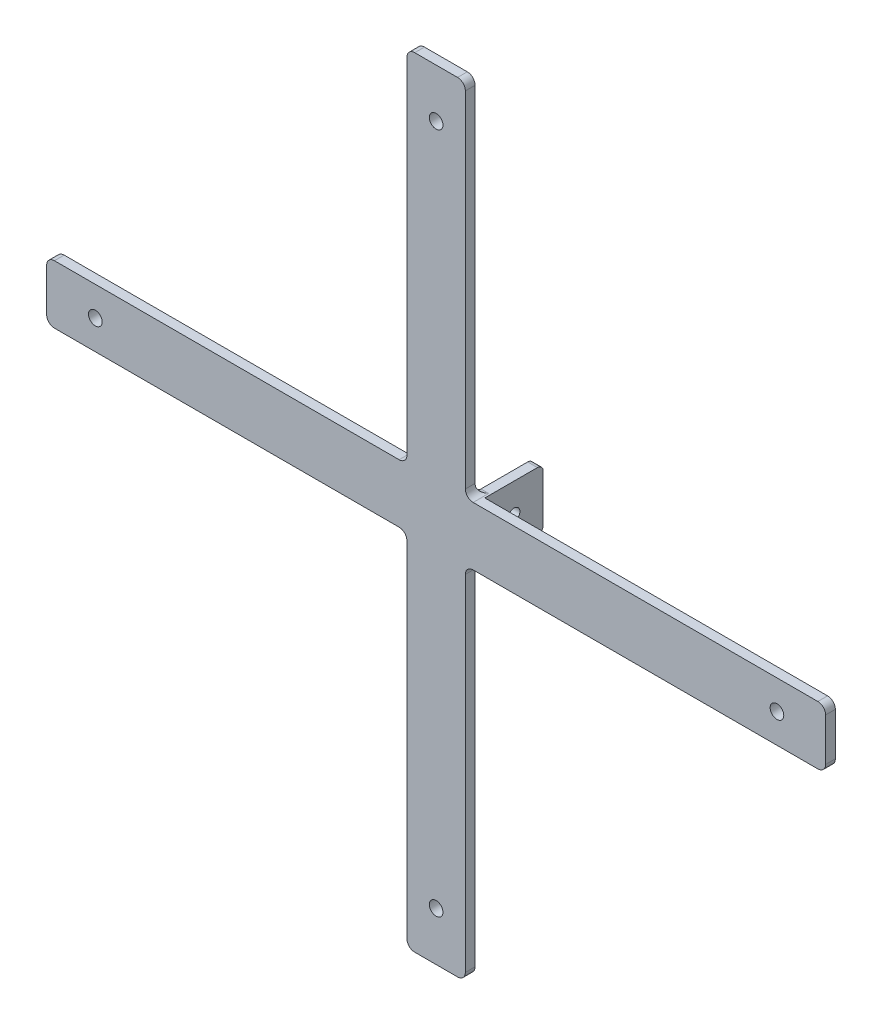
from build123d import *

# Parameters (mm, degrees)
SKETCH1_W               = 185
SKETCH1_H               = 30
SKETCH1_W_2             = 30
SKETCH1_H_2             = 185
BOSS_EXTRUDE1_DEPTH     = 5
SKETCH2_W               = 5
SKETCH2_H               = 30
BOSS_EXTRUDE2_DEPTH     = 30
CUT_EXTRUDE1_DEPTH      = 299.83105595
CUT_EXTRUDE1_DEPTH_BACK = 299.83105595
SKETCH3_R               = 3
SKETCH4_R               = 3.5
CUT_EXTRUDE2_DEPTH      = 5
FILLET1_R               = 4
FILLET2_R               = 3
FILLET3_R               = 3


with BuildPart() as part:
    # Sketch1 → Boss-Extrude1 (new body)
    with BuildSketch(Plane.XY):
        with Locations((107.5, 0)):
            Rectangle(SKETCH1_W, SKETCH1_H)
        with Locations((0, 107.5)):
            Rectangle(SKETCH1_W_2, SKETCH1_H_2)
        with Locations((-107.5, 0)):
            Rectangle(SKETCH1_W, SKETCH1_H)
        Rectangle(SKETCH1_W_2, SKETCH1_H)
        with Locations((0, -107.5)):
            Rectangle(SKETCH1_W_2, SKETCH1_H_2)
    extrude(amount=BOSS_EXTRUDE1_DEPTH)

    # Sketch2 → Boss-Extrude2 (add)
    with BuildSketch(Plane(origin=(0, 0, 0), x_dir=(-1, 0, 0), z_dir=(0, 0, -1))):
        with Locations((-17.5, 0)):
            Rectangle(SKETCH2_W, SKETCH2_H)
        with Locations((17.5, 0)):
            Rectangle(SKETCH2_W, SKETCH2_H)
    extrude(amount=BOSS_EXTRUDE2_DEPTH)

    # Sketch3 → Cut-Extrude1 (cut, two sides: drawn at the far end of the back side and taken through both)
    with BuildSketch(Plane(origin=(20, 0, 0), x_dir=(0, 0, -1), z_dir=(1, 0, 0)).offset(-CUT_EXTRUDE1_DEPTH_BACK)):
        with Locations((15, 0)):
            Circle(SKETCH3_R)
    extrude(amount=CUT_EXTRUDE1_DEPTH + CUT_EXTRUDE1_DEPTH_BACK, mode=Mode.SUBTRACT)

    # Sketch4 → Cut-Extrude2 (cut)
    with BuildSketch(Plane.XY.offset(5)):
        with Locations((0, 175)):
            Circle(SKETCH4_R)
        with Locations((175, 0)):
            Circle(SKETCH4_R)
        with Locations((0, -175)):
            Circle(SKETCH4_R)
        with Locations((-175, 0)):
            Circle(SKETCH4_R)
    extrude(amount=-CUT_EXTRUDE2_DEPTH, mode=Mode.SUBTRACT)

    # Fillet1
    fillet1_edges = [part.edges().sort_by_distance(p)[0] for p in [
        (200, -15, 2.5),
        (15, -15, 2.5),
        (15, -200, 2.5),
        (-15, -200, 2.5),
        (-15, -15, 2.5),
        (-200, -15, 2.5),
        (-200, 15, 2.5),
        (-15, 15, 2.5),
        (-15, 200, 2.5),
        (15, 200, 2.5),
        (15, 15, 2.5),
        (200, 15, 2.5),
    ]]
    fillet(fillet1_edges, radius=FILLET1_R)

    # Fillet2
    fillet2_edges = [part.edges().sort_by_distance(p)[0] for p in [
        (17, -15, 0),
        (17, 15, 0),
        (17.5, 15, -30),
        (17.5, -15, -30),
    ]]
    fillet(fillet2_edges, radius=FILLET2_R)

    # Fillet3
    fillet3_edges = [part.edges().sort_by_distance(p)[0] for p in [
        (-17, -15, 0),
        (-17, 15, 0),
        (-17.5, -15, -30),
        (-17.5, 15, -30),
    ]]
    fillet(fillet3_edges, radius=FILLET3_R)


solid = part.part
